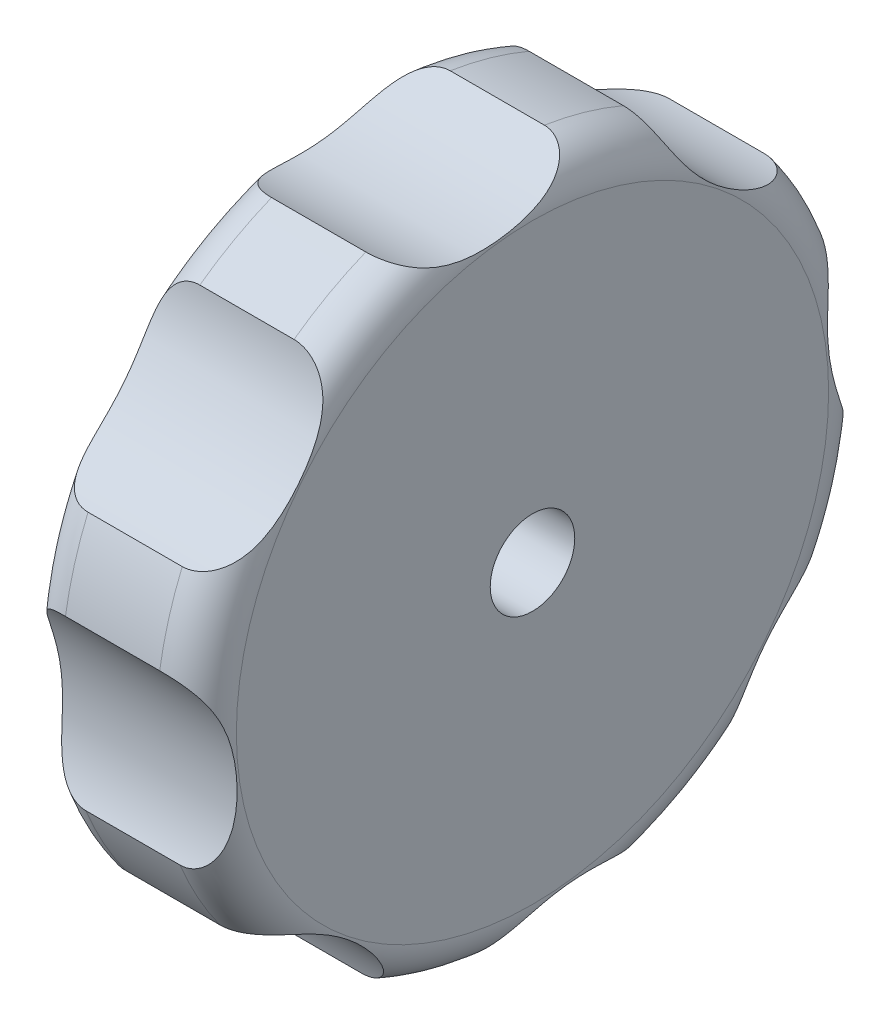
from build123d import *

# Parameters (mm, degrees)
SKETCH1_R           = 25
SKETCH1_R_2         = 3.14
BOSS_EXTRUDE1_DEPTH = 13
CUT_EXTRUDE1_REACH  = 39.67
SKETCH1_3_R         = 3.14
FILLET1_R           = 3
FILLET2_R           = 3
CUT_EXTRUDE2_REACH  = 39.67
SKETCH2_R           = 12.5
CIRPATTERN1_COUNT   = 8
CUT_EXTRUDE3_DEPTH  = 5.31


with BuildPart() as part:
    # Sketch1 → Boss-Extrude1 (new body)
    # profile 1 of 2: a face of its own
    with BuildSketch(Plane(origin=(0, 0, 0), x_dir=(0, 0, -1), z_dir=(1, 0, 0))):
        with Locations(Location((0, 0, 0), (0, 0, 180))):
            Circle(SKETCH1_R)
        Circle(SKETCH1_R_2, mode=Mode.SUBTRACT)
    # profile 2 of 2: a face of its own
    with BuildSketch(Plane(origin=(0, 0, 0), x_dir=(0, 0, -1), z_dir=(1, 0, 0))):
        Circle(SKETCH1_R_2)
    extrude(amount=BOSS_EXTRUDE1_DEPTH)

    # Sketch1<3> → Cut-Extrude1 (cut, up to next)
    with BuildSketch(Plane(origin=(0, 0, 0), x_dir=(0, 0, -1), z_dir=(1, 0, 0)), mode=Mode.PRIVATE) as cut_extrude1_sk1:
        Circle(SKETCH1_3_R)
    cut_extrude1_tool1 = extrude(cut_extrude1_sk1.sketch, amount=CUT_EXTRUDE1_REACH, mode=Mode.PRIVATE) & part.part
    add(cut_extrude1_tool1.solids().sort_by_distance((0, 0, 0))[0], mode=Mode.SUBTRACT)

    # Fillet1
    fillet1_edges = [part.edges().sort_by_distance(p)[0] for p in [
        (13, 0, -25),
    ]]
    fillet(fillet1_edges, radius=FILLET1_R)

    # Fillet2
    fillet2_edges = [part.edges().sort_by_distance(p)[0] for p in [
        (0, 0, -25),
    ]]
    fillet(fillet2_edges, radius=FILLET2_R)

    # Sketch2 → Cut-Extrude2 (cut, up to next)
    with BuildSketch(Plane(origin=(13, 0, 0), x_dir=(0, 0, -1), z_dir=(1, 0, 0)), mode=Mode.PRIVATE) as cut_extrude2_sk1:
        with Locations((-3.954086762, 34.431697657)):
            Circle(SKETCH2_R)
    cut_extrude2_tool1 = extrude(cut_extrude2_sk1.sketch, amount=-CUT_EXTRUDE2_REACH, mode=Mode.PRIVATE) & part.part
    cut_extrude2 = cut_extrude2_tool1.solids().sort_by_distance((13, 34.431698, 3.954087))[0]
    add(cut_extrude2, mode=Mode.SUBTRACT)

    # CirPattern1: Cut-Extrude2 ×8 about axis
    cirpattern1_axis = Axis((0, 0, 0), (1, 0, 0))
    for i in range(1, CIRPATTERN1_COUNT):
        add(cut_extrude2.rotate(cirpattern1_axis, i * 360 / CIRPATTERN1_COUNT), mode=Mode.SUBTRACT)

    # Sketch3 → Cut-Extrude3 (cut)
    with BuildSketch(Plane.ZY):
        Polygon((6.362399966, 0), (3.181199983, 5.51), (-3.181199983, 5.51), (-6.362399966, 0), (-3.181199983, -5.51), (3.181199983, -5.51), align=None)
    extrude(amount=-CUT_EXTRUDE3_DEPTH, mode=Mode.SUBTRACT)


solid = part.part
